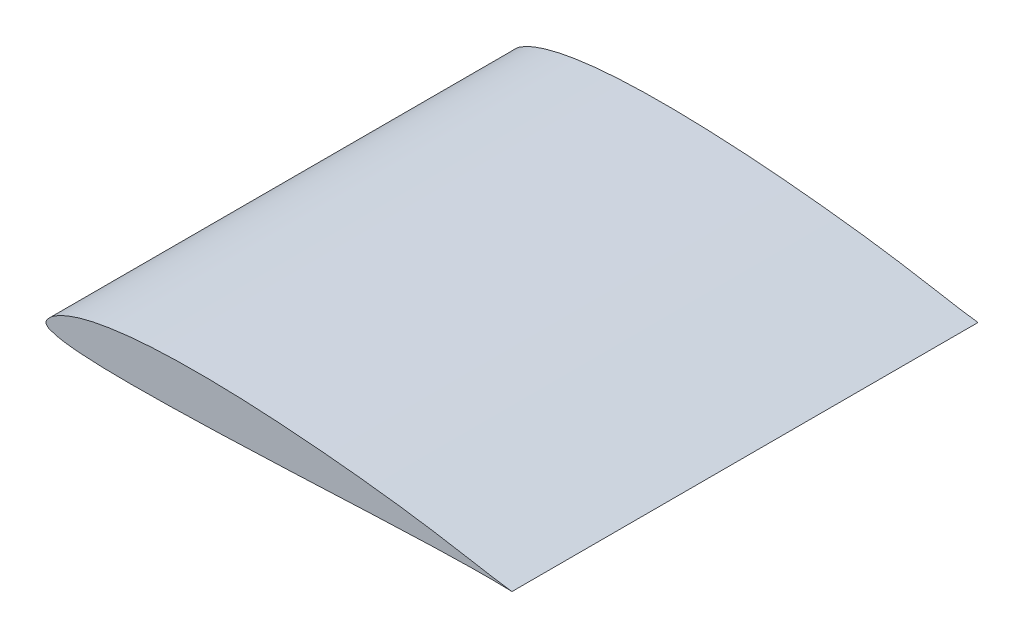
from build123d import *

# Parameters (mm, degrees)
BOSS_EXTRUDE1_DEPTH = 1


with BuildPart() as part:
    # Sketch2 → Boss-Extrude1 (new body)
    with BuildSketch(Plane.XY):
        with BuildLine():
            Line((0.99671, 0.00015), (1, 0))
            add(Edge.make_bspline(
                [(1, 0), (0.998903108, 0.000121407), (0.994565905, 0.00060146), (0.984999997, 0.001862596), (0.969484159, 0.004190621), (0.948529815, 0.007678196), (0.922672969, 0.012198814), (0.892439862, 0.017529266), (0.858309633, 0.023378215), (0.820694397, 0.029436711), (0.779952035, 0.035418329), (0.736439056, 0.041161248), (0.690574078, 0.046627683), (0.62620691, 0.053558876), (0.543750962, 0.060973393), (0.460771418, 0.066263636), (0.379551076, 0.069445541), (0.317100784, 0.070224632), (0.257287933, 0.068807399), (0.216031915, 0.066695621), (0.177714573, 0.06345761), (0.14263253, 0.059163439), (0.111052131, 0.053832559), (0.083177659, 0.047570672), (0.059185142, 0.040514815), (0.039144979, 0.032821644), (0.023254807, 0.02473669), (0.011186579, 0.016610891), (0.003774537, 0.008823737), (-0.001120263, 0.001332723), (0.002215245, -0.006573309), (0.011764719, -0.010149126), (0.024896537, -0.014285856), (0.043591865, -0.017348572), (0.067034847, -0.019960326), (0.09534176, -0.021783939), (0.128175654, -0.022950638), (0.165268517, -0.023475317), (0.222054551, -0.023440834), (0.283068636, -0.022383498), (0.365319495, -0.020131314), (0.434815088, -0.017676635), (0.505626194, -0.014822066), (0.55928484, -0.012517915), (0.612437184, -0.010171711), (0.664475391, -0.00784426), (0.714791147, -0.005658865), (0.762772301, -0.003658163), (0.807809389, -0.002014017), (0.849289308, -0.000708153), (0.88663728, 0.000183559), (0.919314986, 0.00071457), (0.946846558, 0.000918232), (0.968797692, 0.000815243), (0.984799457, 0.000567604), (0.99343689, 0.000264761), (0.99671, 0.00015)],
                knots=[0, 0, 0, 0, 0.001635356, 0.006466337, 0.014296592, 0.024884209, 0.037943993, 0.053194137, 0.070376569, 0.089257218, 0.109651763, 0.131396199, 0.15429467, 0.178096903, 0.227328973, 0.276966075, 0.301296827, 0.347773046, 0.369493849, 0.389946985, 0.408979416, 0.42646579, 0.442306729, 0.45642124, 0.468773538, 0.47934515, 0.488155641, 0.495223141, 0.500608248, 0.504417036, 0.507344225, 0.511892731, 0.518766333, 0.5280624, 0.539750485, 0.553781924, 0.570059197, 0.588441486, 0.608747967, 0.65420771, 0.678865071, 0.730677503, 0.757253937, 0.783882587, 0.810265561, 0.836095192, 0.861073222, 0.884896986, 0.907258357, 0.92785625, 0.946394646, 0.962618154, 0.976286171, 0.987192828, 0.99514679, 1, 1, 1, 1], degree=3))
        make_face()
    extrude(amount=BOSS_EXTRUDE1_DEPTH)


solid = part.part
